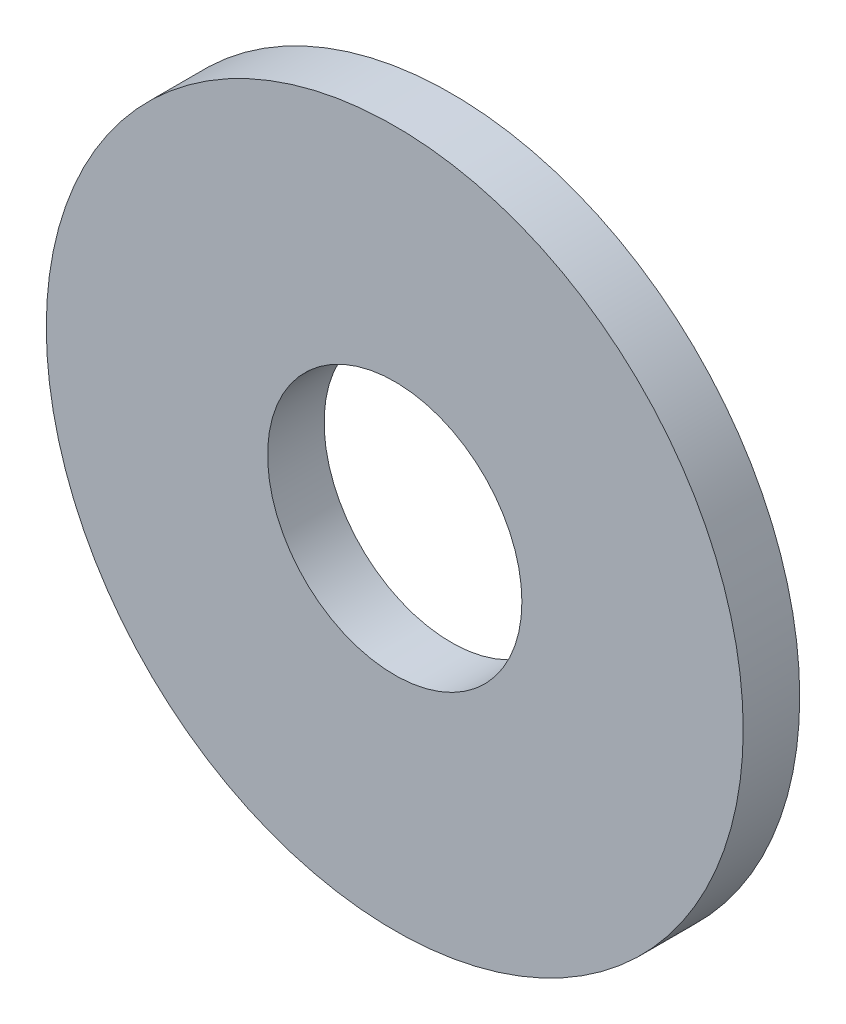
from build123d import *

# Parameters (mm, degrees)
SKETCH3_R           = 7.4
SKETCH3_R_2         = 2.7
BOSS_EXTRUDE1_DEPTH = 0.6


with BuildPart() as part:
    # Sketch3 → Boss-Extrude1 (new, symmetric)
    with BuildSketch(Plane.XY):
        Circle(SKETCH3_R)
        Circle(SKETCH3_R_2, mode=Mode.SUBTRACT)
    extrude(amount=BOSS_EXTRUDE1_DEPTH, both=True)


solid = part.part
